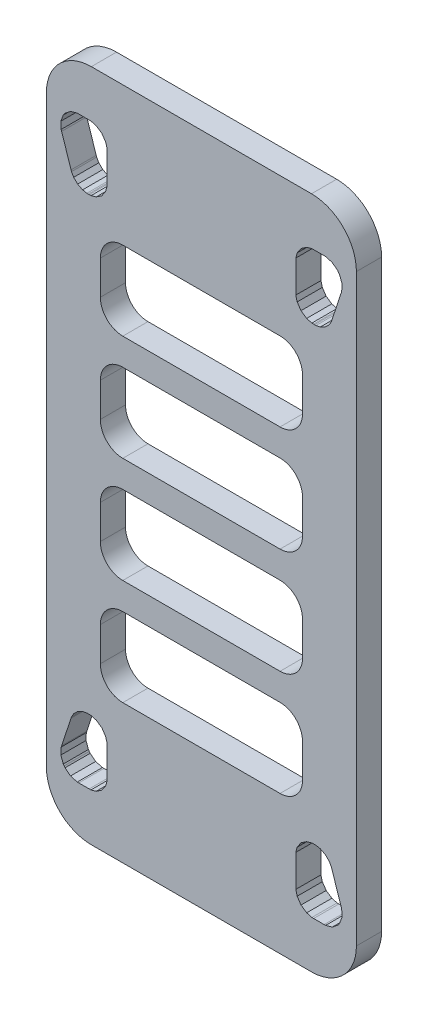
from build123d import *

# Parameters (mm, degrees)
MODEL_W             = 69
MODEL_H             = 150
MODEL_W_2           = 45
MODEL_H_2           = 17.549304405
MODEL_H_3           = 17.549304404
BOSS_EXTRUDE1_DEPTH = 5.6
FILLET1_R           = 10
FILLET2_R           = 5


with BuildPart() as part:
    # Model → Boss-Extrude1 (new body)
    with BuildSketch(Plane.XY):
        with Locations((80.965167, 148.011716788)):
            Rectangle(MODEL_W, MODEL_H)
        with Locations((80.965167, 159.786368991)):
            Rectangle(MODEL_W_2, MODEL_H_2, mode=Mode.SUBTRACT)
        with Locations((80.965167, 183.335673395)):
            Rectangle(MODEL_W_2, MODEL_H_3, mode=Mode.SUBTRACT)
        with Locations((80.965167, 136.237064586)):
            Rectangle(MODEL_W_2, MODEL_H_3, mode=Mode.SUBTRACT)
        with Locations((80.965167, 112.687760182)):
            Rectangle(MODEL_W_2, MODEL_H_3, mode=Mode.SUBTRACT)
        Polygon((105.926079426, 198.110325597), (106.146551371, 198.108293598), (106.462865959, 198.106261598), (107.414180388, 198.293544218), (108.520604111, 198.844893414), (109.398766558, 199.71425053), (109.885769103, 200.555498319), (109.984998412, 200.855218244), (112.087101886, 207.226891318), (112.190056527, 207.542867239), (112.252032512, 209.101410849), (111.70865689, 210.547690825), (111.515176602, 210.816482466), (111.320006162, 211.085959339), (110.098534463, 212.052809224), (108.599544612, 212.48043722), (108.269000143, 212.479948671), (105.948092754, 212.479948671), (105.560658184, 212.469111341), (104.397338475, 212.149410087), (103.133434791, 211.291228969), (102.278640338, 210.021906619), (101.96638975, 208.85858691), (101.96638975, 208.469120341), (101.96638975, 202.110316597), (101.96638975, 201.723898027), (102.276947005, 200.56633565), (103.123952127, 199.298706633), (104.382775812, 198.437138849), (105.53830619, 198.113373596), align=None, mode=Mode.SUBTRACT)
        Polygon((56.006286573, 198.110325597), (55.786153295, 198.108293598), (55.468145374, 198.106261598), (54.515814946, 198.293544218), (53.410068555, 198.844893414), (52.531906108, 199.71425053), (52.046596896, 200.555498319), (51.947367588, 200.855218244), (49.84560278, 207.226891318), (49.740954806, 207.542867239), (49.678301488, 209.101410849), (50.213056021, 210.56377315), (50.409482639, 210.831658417), (50.604215924, 211.100221016), (51.829850284, 212.061356776), (53.331159242, 212.481980671), (53.663729825, 212.479948671), (55.983959888, 212.479948671), (56.37003558, 212.481751973), (57.534497197, 212.167486259), (58.804766127, 211.315229016), (59.662770703, 210.049900432), (59.982483497, 208.888061364), (59.965637583, 208.469120341), (59.965637583, 202.110316597), (59.965637583, 201.723898027), (59.653386995, 200.56633565), (58.806381873, 199.298706633), (57.547896854, 198.437138849), (56.392366477, 198.113373596), align=None, mode=Mode.SUBTRACT)
        Polygon((105.926079426, 97.910059981), (106.146551371, 97.911753313), (106.462865959, 97.915478646), (107.414180388, 97.727857359), (108.520604111, 97.177185497), (109.398766558, 96.307828381), (109.885769103, 95.466580591), (109.984998412, 95.164828667), (112.087101886, 88.792816927), (112.190056527, 88.478534338), (112.252032512, 86.922700061), (111.709769882, 85.473734765), (111.516141042, 85.203024117), (111.320811964, 84.933999869), (110.098774764, 83.968201755), (108.599536956, 83.541110091), (108.268994213, 83.541452906), (105.948092754, 83.541452906), (105.560658184, 83.55296757), (104.397338475, 83.872330157), (103.133434791, 84.732543275), (102.278640338, 86.002204291), (101.96638975, 87.164846667), (101.96638975, 87.55092657), (101.96638975, 93.910068981), (101.96638975, 94.29750355), (102.276947005, 95.457097927), (103.123952127, 96.723372277), (104.382775812, 97.584940062), (105.53830619, 97.906334648), align=None, mode=Mode.SUBTRACT)
        Polygon((56.006286573, 97.910059981), (55.786153295, 97.911753313), (55.468145374, 97.915478646), (54.515814946, 97.727857359), (53.410068555, 97.177185497), (52.531906108, 96.307828381), (52.046596896, 95.466580591), (51.947367588, 95.164828667), (49.84560278, 88.792816927), (49.740954806, 88.478534338), (49.678301488, 86.922700061), (50.213056021, 85.459660426), (50.409482639, 85.189743161), (50.604215924, 84.921519228), (51.829850284, 83.960722135), (53.331159242, 83.539759573), (53.663729825, 83.541452906), (55.983953956, 83.541452906), (56.37003894, 83.541906995), (57.534315492, 83.856513857), (58.804094924, 84.711544578), (59.661361982, 85.977712552), (59.980393619, 87.139060758), (59.981971512, 87.525137437), (59.981971512, 93.884279847), (59.981971512, 94.271714417), (59.653386995, 95.457097927), (58.806381873, 96.723372277), (57.547896854, 97.584940062), (56.392366477, 97.906334648), align=None, mode=Mode.SUBTRACT)
    extrude(amount=BOSS_EXTRUDE1_DEPTH)

    # Fillet1
    fillet1_edges = [part.edges().sort_by_distance(p)[0] for p in [
        (115.465167, 73.011716788, 2.8),
        (46.465167, 73.011716788, 2.8),
        (46.465167, 223.011716788, 2.8),
        (115.465167, 223.011716788, 2.8),
    ]]
    fillet(fillet1_edges, radius=FILLET1_R)

    # Fillet2
    fillet2_edges = [part.edges().sort_by_distance(p)[0] for p in [
        (58.465167, 192.110325597, 2.8),
        (58.465167, 174.561021193, 2.8),
        (103.465167, 174.561021193, 2.8),
        (103.465167, 192.110325597, 2.8),
        (58.465167, 168.561021193, 2.8),
        (58.465167, 151.011716788, 2.8),
        (103.465167, 151.011716788, 2.8),
        (103.465167, 168.561021193, 2.8),
        (58.465167, 127.462412384, 2.8),
        (103.465167, 127.462412384, 2.8),
        (103.465167, 145.011716788, 2.8),
        (58.465167, 145.011716788, 2.8),
        (58.465167, 103.91310798, 2.8),
        (103.465167, 103.91310798, 2.8),
        (103.465167, 121.462412384, 2.8),
        (58.465167, 121.462412384, 2.8),
    ]]
    fillet(fillet2_edges, radius=FILLET2_R)


solid = part.part
